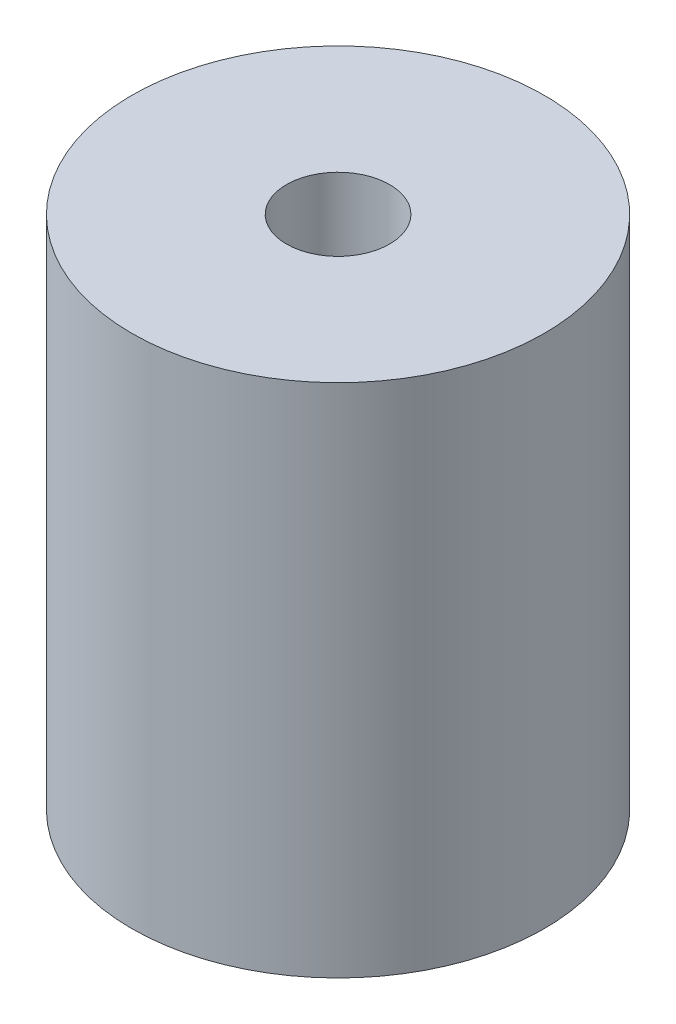
from build123d import *

# Parameters (mm, degrees)
SKETCH_1_R          = 10
EXTRUDE_1_DEPTH     = 25
HOLE_WIZARD_1_D     = 5
HOLE_WIZARD_1_DEPTH = 12.5
HOLE_WIZARD_2_D     = 8
HOLE_WIZARD_2_DEPTH = 12.5


with BuildPart() as part:
    # 草图1 → 凸台-拉伸1 (new body)
    with BuildSketch(Plane(origin=(0, 0, 0), x_dir=(1, 0, 0), z_dir=(0, 1, 0))):
        with Locations(Location((0, 0, 0), (0, 0, 270))):
            Circle(SKETCH_1_R)
    extrude(amount=EXTRUDE_1_DEPTH)

    # 孔1
    with Locations(Plane(origin=(0, 25, 0), x_dir=(1, 0, 0), z_dir=(0, 1, 0))):
        with Locations((0, 0)):
            Hole(HOLE_WIZARD_1_D / 2, depth=HOLE_WIZARD_1_DEPTH)

    # 孔2
    with Locations(Plane(origin=(0, 0, 0), x_dir=(-1, 0, 0), z_dir=(0, -1, 0))):
        with Locations((0, 0)):
            Hole(HOLE_WIZARD_2_D / 2, depth=HOLE_WIZARD_2_DEPTH)


solid = part.part
